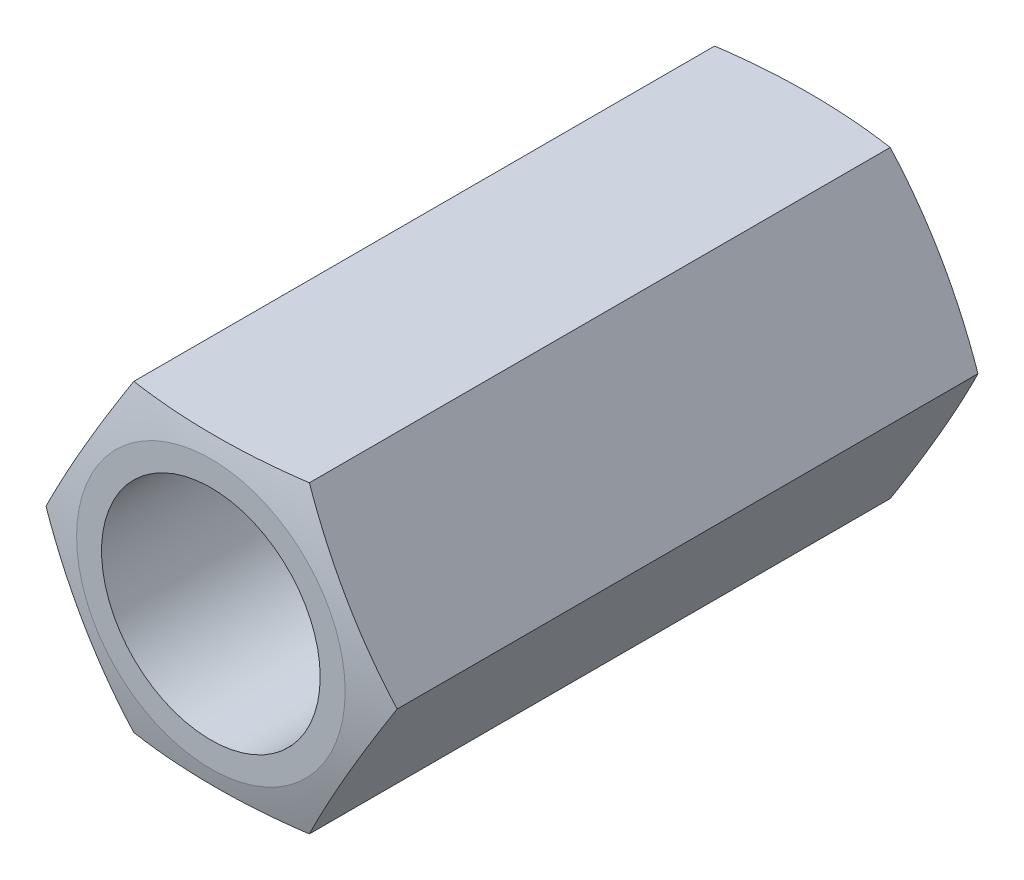
from build123d import *

# Parameters (mm, degrees)
SKETCH1_R           = 3.8989
BOSS_EXTRUDE1_DEPTH = 25.4
SKETCH2_R           = 4.6101
CUT_EXTRUDE1_DEPTH  = 15.875


with BuildPart() as part:
    # Sketch1 → Boss-Extrude1 (new body)
    with BuildSketch(Plane.XY):
        Polygon((7.405671903, 0), (3.702835951, 6.4135), (-3.702835951, 6.4135), (-7.405671903, 0), (-3.702835951, -6.4135), (3.702835951, -6.4135), align=None)
        Circle(SKETCH1_R, mode=Mode.SUBTRACT)
    extrude(amount=BOSS_EXTRUDE1_DEPTH)

    # Sketch2 → Cut-Extrude1 (cut)
    with BuildSketch(Plane.XY.offset(25.4)):
        Circle(SKETCH2_R)
    extrude(amount=-CUT_EXTRUDE1_DEPTH, mode=Mode.SUBTRACT)

    # Sketch3 → Cut-Revolve1 (revolve, cut)
    with BuildSketch(Plane(origin=(0, 0, 0), x_dir=(0, 0, -1), z_dir=(1, 0, 0)), mode=Mode.PRIVATE) as cut_revolve1_sk:
        with BuildLine():
            Line((0.623579889, 0), (5.658105548, 0))
            ThreePointArc((5.658105548, 0), (5.185391635, 5.398123633), (3.781639599, 10.631925064))
            Line((3.781639599, 10.631925064), (-1.647339525, 10.631925064))
            ThreePointArc((-1.647339525, 10.631925064), (0.049518342, 5.435874022), (0.623579889, 0))
        make_face()
        with BuildLine():
            Line((-23.752660475, 10.631925064), (-29.181639599, 10.631925064))
            ThreePointArc((-29.181639599, 10.631925064), (-30.585391635, 5.398123633), (-31.058105548, 0))
            Line((-31.058105548, 0), (-26.023579889, 0))
            ThreePointArc((-26.023579889, 0), (-25.449518342, 5.435874022), (-23.752660475, 10.631925064))
        make_face()
    revolve(cut_revolve1_sk.sketch.rotate(Axis((0, 0, 21.887655645), (0, 0, -1)), 90), axis=Axis((0, 0, 21.887655645), (0, 0, -1)), mode=Mode.SUBTRACT)


solid = part.part
